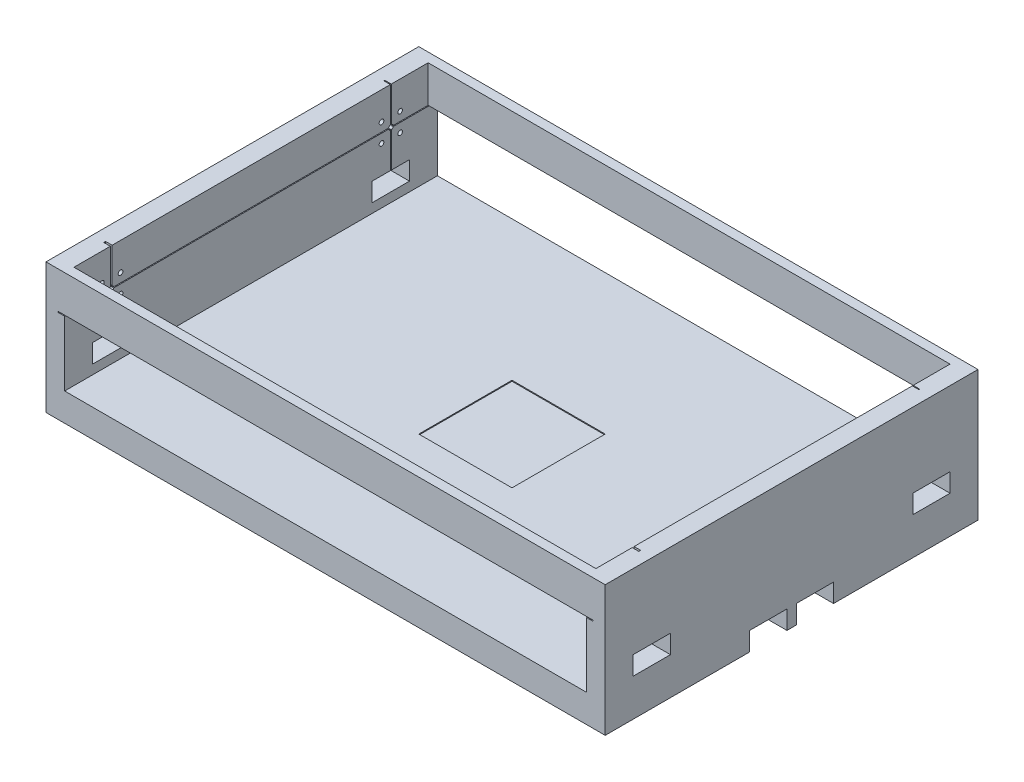
from build123d import *

# Parameters (mm, degrees)
BASE_W                   = 600
BASE_H                   = 400
EXTRUDE_1_DEPTH          = 120
SKETCH_5_W               = 600
SKETCH_5_H               = 10
SKETCH_5_H_2             = 5
EXTRUDE_4_DEPTH          = 20
SKETCH_6_W               = 30
SKETCH_6_H               = 155
EXTRUDE_5_DEPTH          = 20
SKETCH_7_W               = 560
SKETCH_7_H               = 110
CUT_EXTRUDE_1_DEPTH      = 732.0266753
CUT_EXTRUDE_2_DEPTH      = 565
CUT_EXTRUDE_2_DEPTH_BACK = 5
SKETCH_8_R               = 2.5
CUT_EXTRUDE_3_DEPTH      = 715.702735408
CUT_EXTRUDE_3_DEPTH_BACK = 715.702735408
SKETCH_9_W               = 40
SKETCH_9_H               = 20
SKETCH_10_W              = 100
SKETCH_10_H              = 100
CUT_EXTRUDE_4_DEPTH      = 1
CUT_EXTRUDE_5_DEPTH      = 567
CUT_EXTRUDE_5_DEPTH_BACK = 7
SKETCH_11_W              = 400
SKETCH_11_H              = 1
CUT_EXTRUDE_7_DEPTH      = 567
CUT_EXTRUDE_7_DEPTH_BACK = 7
SKETCH_13_W              = 1
SKETCH_13_H              = 80
SKETCH_13_W_2            = 2
SKETCH_15_W              = 10
SKETCH_15_H              = 39.5
EXTRUDE_7_DEPTH          = 561


with BuildPart() as part:
    # base → 凸台-拉伸1 (new body)
    with BuildSketch(Plane(origin=(0, 0, 0), x_dir=(1, 0, 0), z_dir=(0, 1, 0))):
        with Locations((300, -200)):
            Rectangle(BASE_W, BASE_H)
    extrude(amount=EXTRUDE_1_DEPTH)

    # 草图5 → 凸台-拉伸4 (add)
    with BuildSketch(Plane.XZ):
        with Locations((300, 150)):
            Rectangle(SKETCH_5_W, SKETCH_5_H)
        with Locations((300, 100)):
            Rectangle(SKETCH_5_W, SKETCH_5_H)
        with Locations((300, 2.5)):
            Rectangle(SKETCH_5_W, SKETCH_5_H_2)
        with Locations((300, 50)):
            Rectangle(SKETCH_5_W, SKETCH_5_H)
        with Locations((300, 250)):
            Rectangle(SKETCH_5_W, SKETCH_5_H)
        with Locations((300, 200)):
            Rectangle(SKETCH_5_W, SKETCH_5_H)
        with Locations((300, 300)):
            Rectangle(SKETCH_5_W, SKETCH_5_H)
        with Locations((300, 350)):
            Rectangle(SKETCH_5_W, SKETCH_5_H)
        with Locations((300, 397.5)):
            Rectangle(SKETCH_5_W, SKETCH_5_H_2)
    extrude(amount=EXTRUDE_4_DEPTH)

    # 草图6 → 凸台-拉伸5 (add)
    with BuildSketch(Plane.XZ):
        with Locations((15, 322.5)):
            Rectangle(SKETCH_6_W, SKETCH_6_H)
        with Locations((15, 77.5)):
            Rectangle(SKETCH_6_W, SKETCH_6_H)
        with Locations((585, 322.5)):
            Rectangle(SKETCH_6_W, SKETCH_6_H)
        with Locations((585, 77.5)):
            Rectangle(SKETCH_6_W, SKETCH_6_H)
    extrude(amount=EXTRUDE_5_DEPTH)

    # 草图7 → 切除-拉伸1 (cut, through all)
    with BuildSketch(Plane.XY.offset(400)):
        with Locations((300, 65)):
            Rectangle(SKETCH_7_W, SKETCH_7_H)
    extrude(amount=-CUT_EXTRUDE_1_DEPTH, mode=Mode.SUBTRACT)

    # 草图8 → 切除-拉伸2 (cut, two sides: drawn at the far end of the back side and taken through both)
    with BuildSketch(Plane(origin=(20, 0, 0), x_dir=(0, 0, -1), z_dir=(1, 0, 0)).offset(-CUT_EXTRUDE_2_DEPTH_BACK)):
        with Locations(Location((-360, 90, 0), (0, 0, 90))):
            Circle(SKETCH_8_R)
        with Locations(Location((-60, 90, 0), (0, 0, 90))):
            Circle(SKETCH_8_R)
        with Locations(Location((-340, 70, 0), (0, 0, 90))):
            Circle(SKETCH_8_R)
        with Locations(Location((-360, 70, 0), (0, 0, 90))):
            Circle(SKETCH_8_R)
        with Locations(Location((-340, 90, 0), (0, 0, 90))):
            Circle(SKETCH_8_R)
        with Locations(Location((-60, 70, 0), (0, 0, 90))):
            Circle(SKETCH_8_R)
        with Locations(Location((-40, 70, 0), (0, 0, 90))):
            Circle(SKETCH_8_R)
        with Locations(Location((-40, 90, 0), (0, 0, 90))):
            Circle(SKETCH_8_R)
        with Locations(Location((-350, 80, 0), (0, 0, 90))):
            Circle(SKETCH_8_R)
        with Locations(Location((-50, 80, 0), (0, 0, 90))):
            Circle(SKETCH_8_R)
    extrude(amount=CUT_EXTRUDE_2_DEPTH + CUT_EXTRUDE_2_DEPTH_BACK, mode=Mode.SUBTRACT)

    # 草图9 → 切除-拉伸3 (cut, two sides: drawn at the far end of the back side and taken through both)
    with BuildSketch(Plane(origin=(20, 0, 0), x_dir=(0, 0, -1), z_dir=(1, 0, 0)).offset(-CUT_EXTRUDE_3_DEPTH_BACK)):
        with Locations((-350, 30)):
            Rectangle(SKETCH_9_W, SKETCH_9_H)
        with Locations((-50, 30)):
            Rectangle(SKETCH_9_W, SKETCH_9_H)
    extrude(amount=CUT_EXTRUDE_3_DEPTH + CUT_EXTRUDE_3_DEPTH_BACK, mode=Mode.SUBTRACT)

    # 草图10 → 切除-拉伸4 (cut)
    with BuildSketch(Plane(origin=(0, 10, 0), x_dir=(1, 0, 0), z_dir=(0, 1, 0))):
        with Locations((300, -200)):
            Rectangle(SKETCH_10_W, SKETCH_10_H)
    extrude(amount=-CUT_EXTRUDE_4_DEPTH, mode=Mode.SUBTRACT)

    # 草图11 → 切除-拉伸5 (cut, two sides: drawn at the far end of the back side and taken through both)
    with BuildSketch(Plane.ZY.offset(-580).offset(-CUT_EXTRUDE_5_DEPTH_BACK)):
        with Locations((200, 80)):
            Rectangle(SKETCH_11_W, SKETCH_11_H)
    extrude(amount=CUT_EXTRUDE_5_DEPTH + CUT_EXTRUDE_5_DEPTH_BACK, mode=Mode.SUBTRACT)

    # 草图13 → 切除-拉伸7 (cut, two sides: drawn at the far end of the back side and taken through both)
    with BuildSketch(Plane.ZY.offset(-580).offset(-CUT_EXTRUDE_7_DEPTH_BACK)):
        with Locations((50, 80)):
            Rectangle(SKETCH_13_W, SKETCH_13_H)
        with Locations((350, 80)):
            Rectangle(SKETCH_13_W_2, SKETCH_13_H)
    extrude(amount=CUT_EXTRUDE_7_DEPTH + CUT_EXTRUDE_7_DEPTH_BACK, mode=Mode.SUBTRACT)

    # 草图15 → 凸台-拉伸7 (add)
    with BuildSketch(Plane(origin=(20, 0, 0), x_dir=(0, 0, -1), z_dir=(1, 0, 0))):
        with Locations((-395, 100.25)):
            Rectangle(SKETCH_15_W, SKETCH_15_H)
        with Locations((-5, 100.25)):
            Rectangle(SKETCH_15_W, SKETCH_15_H)
    extrude(amount=EXTRUDE_7_DEPTH)


solid = part.part
